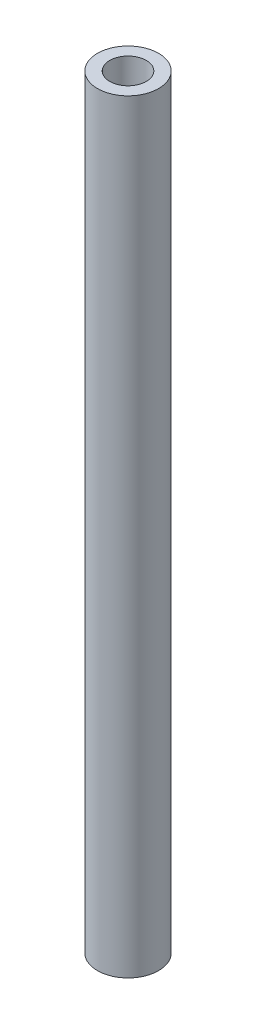
from build123d import *

# Parameters (mm, degrees)
SKETCH1_R              = 3.175
BOSS_EXTRUDE1_DEPTH    = 79.375
ATTACHHMENT_HOLE_D     = 3.7973
ATTACHHMENT_HOLE_DEPTH = 12.7
ATTACHHMENT_HOLE_TIP   = 1.140824014
F_10_24_TAPPED_D       = 3.7973
F_10_24_TAPPED_DEPTH   = 12.7
F_10_24_TAPPED_TIP     = 1.140824014


with BuildPart() as part:
    # Sketch1 → Boss-Extrude1 (new body)
    with BuildSketch(Plane(origin=(0, 0, 0), x_dir=(1, 0, 0), z_dir=(0, 1, 0))):
        with Locations(Location((0, 0, 0), (0, 0, 90))):
            Circle(SKETCH1_R)
    extrude(amount=BOSS_EXTRUDE1_DEPTH)

    # Attachhment Hole
    with Locations(Plane(origin=(0, 79.375, 0), x_dir=(1, 0, 0), z_dir=(0, 1, 0))):
        with Locations((0, 0)):
            Hole(ATTACHHMENT_HOLE_D / 2, depth=ATTACHHMENT_HOLE_DEPTH)
            with Locations((0, 0, -(ATTACHHMENT_HOLE_DEPTH + ATTACHHMENT_HOLE_TIP / 2))):  # 118° drill point
                Cone(0, ATTACHHMENT_HOLE_D / 2, ATTACHHMENT_HOLE_TIP, mode=Mode.SUBTRACT)

    # #10-24 Tapped
    with Locations(Plane(origin=(0, 0, 0), x_dir=(-1, 0, 0), z_dir=(0, -1, 0))):
        with Locations((0, 0)):
            Hole(F_10_24_TAPPED_D / 2, depth=F_10_24_TAPPED_DEPTH)
            with Locations((0, 0, -(F_10_24_TAPPED_DEPTH + F_10_24_TAPPED_TIP / 2))):  # 118° drill point
                Cone(0, F_10_24_TAPPED_D / 2, F_10_24_TAPPED_TIP, mode=Mode.SUBTRACT)


solid = part.part
